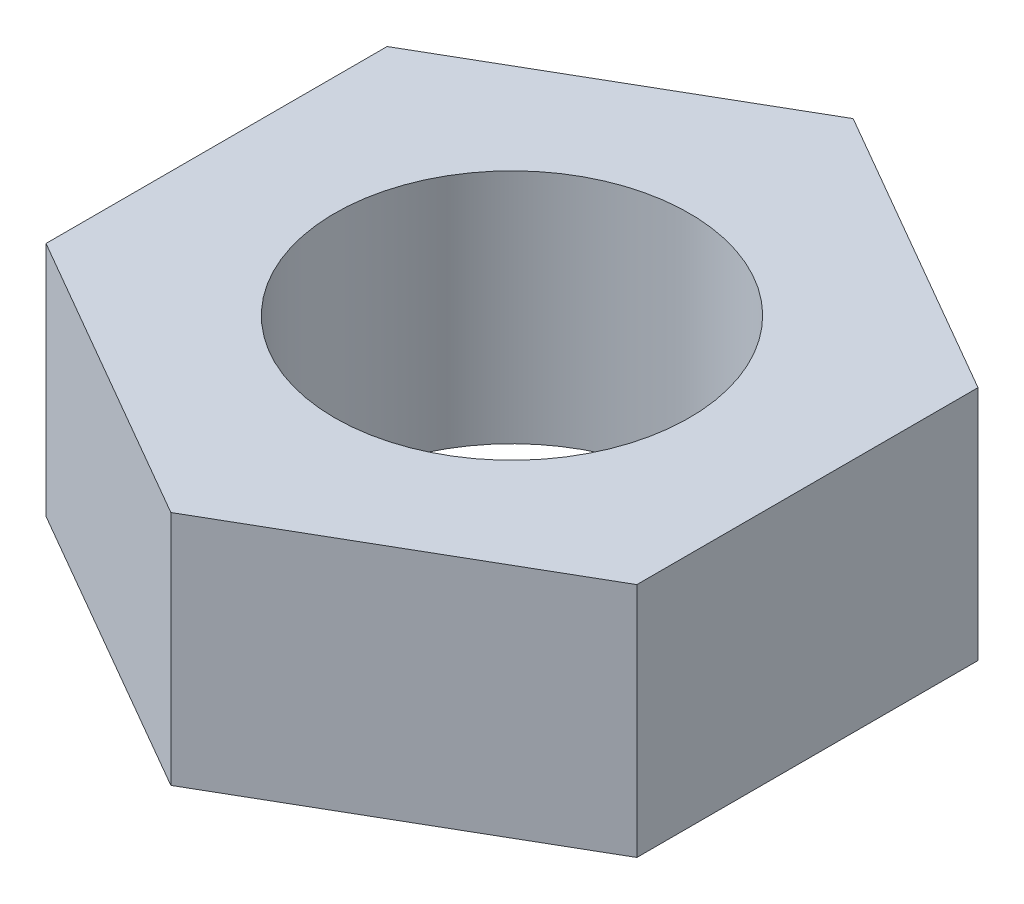
from build123d import *

# Parameters (mm, degrees)
BOSS_EXTRUDE1_DEPTH = 4
CUT_EXTRUDE1_REACH  = 10.622
SKETCH2_R           = 3


with BuildPart() as part:
    # Sketch1 → Boss-Extrude1 (new body)
    with BuildSketch(Plane(origin=(0, 0, 0), x_dir=(1, 0, 0), z_dir=(0, 1, 0))):
        Polygon((5, -2.886751346), (5, 2.886751346), (0, 5.773502692), (-5, 2.886751346), (-5, -2.886751346), (0, -5.773502692), align=None)
    extrude(amount=BOSS_EXTRUDE1_DEPTH)

    # Sketch2 → Cut-Extrude1 (cut, up to next)
    with BuildSketch(Plane(origin=(0, 4, 0), x_dir=(1, 0, 0), z_dir=(0, 1, 0)), mode=Mode.PRIVATE) as cut_extrude1_sk1:
        with Locations(Location((0, 0, 0), (0, 0, 270))):
            Circle(SKETCH2_R)
    cut_extrude1_tool1 = extrude(cut_extrude1_sk1.sketch, amount=-CUT_EXTRUDE1_REACH, mode=Mode.PRIVATE) & part.part
    add(cut_extrude1_tool1.solids().sort_by_distance((0, 4, 0))[0], mode=Mode.SUBTRACT)


solid = part.part
